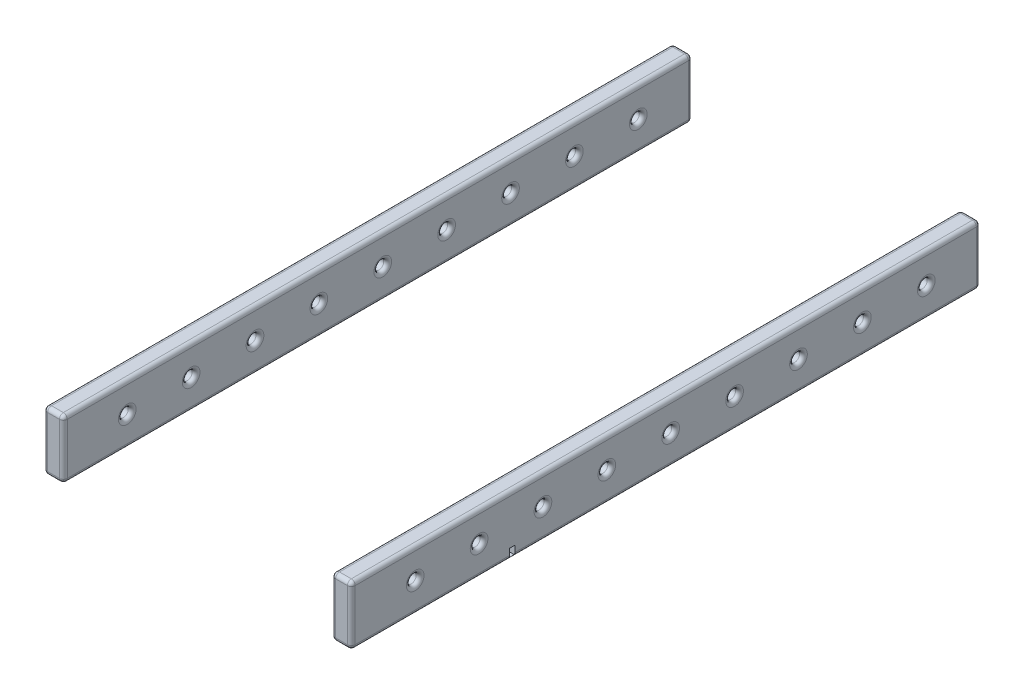
from build123d import *

# Parameters (mm, degrees)
BOSS_EXTRUDE1_DEPTH        = 406.4
BOSS_EXTRUDE1_DEPTH_BACK   = 406.4
SKETCH1_W                  = 25.4
SKETCH1_H                  = 76.2
BOSS_EXTRUDE1_2_DEPTH      = 406.4
BOSS_EXTRUDE1_2_DEPTH_BACK = 406.4
SKETCH2_R                  = 6.35
CUT_EXTRUDE1_DEPTH         = 570.760274238
LPATTERN1_COUNT            = 9
LPATTERN1_PITCH            = 82.55
FILLET1_R                  = 5.08
FILLET2_R                  = 5.08
CUT_EXTRUDE2_START         = -25.4
SKETCH4_W                  = 6.858
SKETCH4_H                  = 10.922
CUT_EXTRUDE2_DEPTH         = 25.4


with BuildPart() as part:
    # Sketch1 → Boss-Extrude1 (new, two sides: drawn at the far end of the back side and taken through both)
    with BuildSketch(Plane.XY.offset(-BOSS_EXTRUDE1_DEPTH_BACK)):
        with Locations((-186.055, 0)):
            Rectangle(SKETCH1_W, SKETCH1_H)
    extrude(amount=BOSS_EXTRUDE1_DEPTH + BOSS_EXTRUDE1_DEPTH_BACK)


with BuildPart() as body_2:
    # Sketch1 → Boss-Extrude1 2 (new, two sides: drawn at the far end of the back side and taken through both)
    with BuildSketch(Plane.XY.offset(-BOSS_EXTRUDE1_2_DEPTH_BACK)):
        with Locations((186.055, 0)):
            Rectangle(SKETCH1_W, SKETCH1_H)
    extrude(amount=BOSS_EXTRUDE1_2_DEPTH + BOSS_EXTRUDE1_2_DEPTH_BACK)


with BuildPart() as cut_extrude1_tool:
    # Sketch2 → Cut-Extrude1 (new, symmetric)
    with BuildSketch(Plane(origin=(198.755, 0, 0), x_dir=(0, 0, -1), z_dir=(1, 0, 0))):
        with Locations(Location((-323.85, 0, 0), (0, 0, 90))):
            Circle(SKETCH2_R)
    cut_extrude1 = extrude(amount=CUT_EXTRUDE1_DEPTH, both=True)


with BuildPart() as part_1:
    add(part.part)

    # Cut-Extrude1: cut by cut_extrude1_tool
    add(cut_extrude1_tool.part, mode=Mode.SUBTRACT)


with BuildPart() as body_2_1:
    add(body_2.part)

    # Cut-Extrude1: cut by cut_extrude1_tool
    add(cut_extrude1_tool.part, mode=Mode.SUBTRACT)


with BuildPart() as lpattern1_tool:
    # LPattern1: Cut-Extrude1 ×9
    with Locations(*[(0, 0, -i * LPATTERN1_PITCH) for i in range(1, LPATTERN1_COUNT)]):
        add(cut_extrude1)


with BuildPart() as part_2:
    add(part_1.part)

    # LPattern1: cut by lpattern1_tool
    add(lpattern1_tool.part, mode=Mode.SUBTRACT)

    # Fillet2
    fillet2_edges = [part_2.edges().sort_by_distance(p)[0] for p in [
        (-173.355, 0, 406.4),
        (-198.755, 0, -406.4),
        (-186.055, 38.1, 406.4),
        (-198.755, 0, 406.4),
        (-186.055, -38.1, 406.4),
        (-186.055, -38.1, -406.4),
        (-173.355, -6.35, 323.85),
        (-198.755, -6.35, 323.85),
        (-173.355, -6.35, 241.3),
        (-198.755, -6.35, 241.3),
        (-173.355, -6.35, 158.75),
        (-198.755, -6.35, 158.75),
        (-173.355, 0, -406.4),
        (-173.355, -6.35, 76.2),
        (-198.755, -6.35, 76.2),
        (-173.355, -6.35, -6.35),
        (-198.755, -6.35, -6.35),
        (-173.355, -6.35, -88.9),
        (-198.755, -6.35, -88.9),
        (-173.355, -6.35, -171.45),
        (-198.755, -6.35, -171.45),
        (-173.355, -6.35, -254),
        (-198.755, -6.35, -254),
        (-173.355, -6.35, -336.55),
        (-198.755, -6.35, -336.55),
        (-173.355, -38.1, 0),
        (-198.755, -38.1, 0),
        (-198.755, 38.1, 0),
        (-173.355, 38.1, 0),
        (-186.055, 38.1, -406.4),
    ]]
    fillet(fillet2_edges, radius=FILLET2_R)


with BuildPart() as body_2_2:
    add(body_2_1.part)

    # LPattern1: cut by lpattern1_tool
    add(lpattern1_tool.part, mode=Mode.SUBTRACT)

    # Fillet1
    fillet1_edges = [body_2_2.edges().sort_by_distance(p)[0] for p in [
        (198.755, -6.35, 323.85),
        (173.355, -6.35, 323.85),
        (198.755, -6.35, 241.3),
        (173.355, -6.35, 241.3),
        (198.755, -6.35, 158.75),
        (173.355, -6.35, 158.75),
        (198.755, 0, 406.4),
        (186.055, 38.1, 406.4),
        (198.755, -6.35, 76.2),
        (173.355, -6.35, 76.2),
        (173.355, 0, 406.4),
        (198.755, -6.35, -6.35),
        (186.055, -38.1, 406.4),
        (173.355, -6.35, -6.35),
        (198.755, 0, -406.4),
        (198.755, -6.35, -88.9),
        (173.355, -6.35, -88.9),
        (186.055, 38.1, -406.4),
        (173.355, 0, -406.4),
        (198.755, -6.35, -171.45),
        (173.355, -6.35, -171.45),
        (186.055, -38.1, -406.4),
        (198.755, 38.1, 0),
        (173.355, 38.1, 0),
        (198.755, -6.35, -254),
        (173.355, -38.1, 0),
        (173.355, -6.35, -254),
        (198.755, -38.1, 0),
        (198.755, -6.35, -336.55),
        (173.355, -6.35, -336.55),
    ]]
    fillet(fillet1_edges, radius=FILLET1_R)

    # Sketch4 → Cut-Extrude2 (cut)
    with BuildSketch(Plane(origin=(198.755, 0, 0), x_dir=(0, 0, -1), z_dir=(1, 0, 0)).offset(CUT_EXTRUDE2_START)):
        with Locations((-198.501, -30.353)):
            Rectangle(SKETCH4_W, SKETCH4_H)
    extrude(amount=CUT_EXTRUDE2_DEPTH, mode=Mode.SUBTRACT)


solid = Compound([part_2.part, body_2_2.part])
